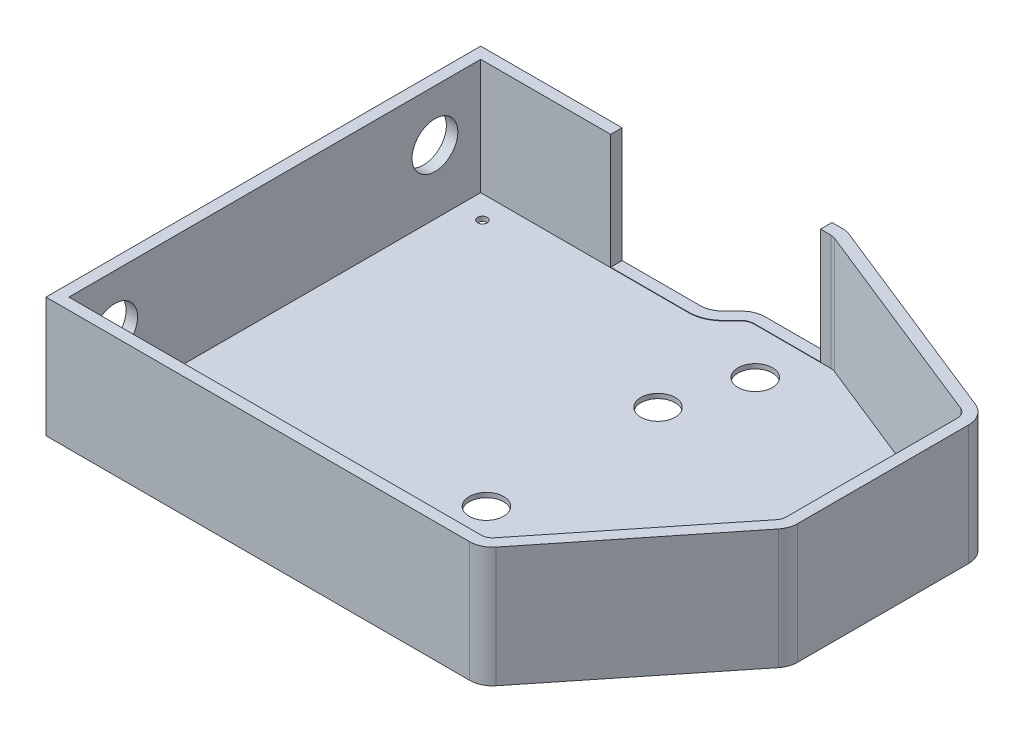
from build123d import *

# Parameters (mm, degrees)
RESSALTO_EXTRUS_O1_DEPTH = 10.5
RESSALTO_EXTRUS_O2_START = -0.405481833
RESSALTO_EXTRUS_O2_DEPTH = 0.405481833
ESBO_O6_R                = 1.5
ESBO_O6_R_2              = 0.439880444
ESBO_O6_R_3              = 0.420000653
CORTE_EXTRUS_O1_DEPTH    = 10
ESBO_O7_R                = 2
CORTE_EXTRUS_O2_DEPTH    = 10
ESBO_O8_W                = 16.345048289
ESBO_O8_H                = 10.10072272
CORTE_EXTRUS_O3_DEPTH    = 6


with BuildPart() as part:
    # Esboço1 → Ressalto-extrusão1 (new body)
    with BuildSketch(Plane.XZ.offset(-2000)):
        with BuildLine():
            Line((26.191736717, -104.725419486), (63.230487022, -104.725419486))
            ThreePointArc((63.230487022, -104.725419486), (64.096864483, -104.922813013), (64.79222464, -105.476029391))
            Line((64.79222464, -105.476029391), (75.753474335, -119.17759151))
            ThreePointArc((75.753474335, -119.17759151), (76.078993355, -119.764967722), (76.191736717, -120.426981605))
            Line((76.191736717, -120.426981605), (76.191736717, -135.371353563))
            ThreePointArc((76.191736717, -135.371353563), (75.847871178, -136.492611182), (74.934518069, -137.228306945))
            Line((74.934518069, -137.228306945), (56.549353262, -144.582372868))
            ThreePointArc((56.549353262, -144.582372868), (56.184786952, -144.689332259), (55.806571909, -144.725419486))
            Line((55.806571909, -144.725419486), (49.020163841, -144.725419486))
            Line((49.020163841, -144.725419486), (48.505389373, -144.65803617))
            Line((48.505389373, -144.65803617), (48.017411303, -144.455878196))
            Line((48.017411303, -144.455878196), (47.605950279, -144.139633048))
            Line((47.605950279, -144.139633048), (46.777523154, -143.311205924))
            ThreePointArc((46.777523154, -143.311205924), (46.128676457, -142.877660421), (45.363309592, -142.725419486))
            Line((45.363309592, -142.725419486), (26.191736717, -142.725419486))
            Line((26.191736717, -142.725419486), (26.191736717, -104.725419486))
        make_face()
        with BuildLine():
            Line((48.266993092, -143.386462299), (47.484629935, -142.604099142))
            ThreePointArc((47.484629935, -142.604099142), (46.511359889, -141.953780888), (45.363309592, -141.725419486))
            Line((45.363309592, -141.725419486), (27.191736717, -141.725419486))
            Line((27.191736717, -141.725419486), (27.191736717, -105.725419486))
            Line((27.191736717, -105.725419486), (63.230487022, -105.725419486))
            ThreePointArc((63.230487022, -105.725419486), (63.663675752, -105.82411625), (64.011355831, -106.100724438))
            Line((64.011355831, -106.100724438), (74.972605526, -119.802286557))
            ThreePointArc((74.972605526, -119.802286557), (75.135365036, -120.095974663), (75.191736717, -120.426981605))
            Line((75.191736717, -120.426981605), (75.191736717, -135.371353563))
            ThreePointArc((75.191736717, -135.371353563), (75.019803947, -135.931982372), (74.563127393, -136.299830254))
            Line((74.563127393, -136.299830254), (56.177962586, -143.653896177))
            ThreePointArc((56.177962586, -143.653896177), (55.995679431, -143.707375873), (55.806571909, -143.725419486))
            Line((55.806571909, -143.725419486), (49.085335215, -143.725419486))
            Line((49.085335215, -143.725419486), (48.766120713, -143.683634718))
            Line((48.766120713, -143.683634718), (48.522121146, -143.582551368))
            Line((48.522121146, -143.582551368), (48.266993092, -143.386462299))
        make_face(mode=Mode.SUBTRACT)
    extrude(amount=RESSALTO_EXTRUS_O1_DEPTH)

    # Esboço5 → Ressalto-extrusão2 (add)
    with BuildSketch(Plane.XZ.offset(-1989.5).offset(RESSALTO_EXTRUS_O2_START)):
        with BuildLine():
            Line((27.191736717, -105.725419486), (63.230487022, -105.725419486))
            ThreePointArc((63.230487022, -105.725419486), (63.663675752, -105.82411625), (64.011355831, -106.100724438))
            Line((64.011355831, -106.100724438), (74.972605526, -119.802286557))
            ThreePointArc((74.972605526, -119.802286557), (75.135365036, -120.095974663), (75.191736717, -120.426981605))
            Line((75.191736717, -120.426981605), (75.191736717, -135.371353563))
            ThreePointArc((75.191736717, -135.371353563), (75.019803947, -135.931982372), (74.563127393, -136.299830254))
            Line((74.563127393, -136.299830254), (56.177962586, -143.653896177))
            ThreePointArc((56.177962586, -143.653896177), (55.995679431, -143.707375873), (55.806571909, -143.725419486))
            Line((55.806571909, -143.725419486), (49.085335215, -143.725419486))
            ThreePointArc((49.085335215, -143.725419486), (48.642453796, -143.637327588), (48.266993092, -143.386462299))
            Line((48.266993092, -143.386462299), (47.484629935, -142.604099142))
            ThreePointArc((47.484629935, -142.604099142), (46.511359889, -141.953780888), (45.363309592, -141.725419486))
            Line((45.363309592, -141.725419486), (27.191736717, -141.725419486))
            Line((27.191736717, -141.725419486), (27.191736717, -105.725419486))
        make_face()
    extrude(amount=RESSALTO_EXTRUS_O2_DEPTH)

    # Esboço6 → Corte-extrusão1 (cut)
    with BuildSketch(Plane.XZ.offset(-1989.5)):
        with Locations(Location((51.191736717, -118.225419486, 0), (0, 0, 270))):
            Circle(ESBO_O6_R)
        with Locations(Location((51.191736717, -133.225419486, 0), (0, 0, 270))):
            Circle(ESBO_O6_R)
        with Locations(Location((72.191736717, -130.725419486, 0), (0, 0, 270))):
            Circle(ESBO_O6_R)
        with Locations(Location((53.191736717, -139.725419486, 0), (0, 0, 270))):
            Circle(ESBO_O6_R)
        with Locations(Location((28.899554792, -108.599940214, 0), (0, 0, 270))):
            Circle(ESBO_O6_R_2)
        with Locations(Location((29.339435236, -139.725419486, 0), (0, 0, 270))):
            Circle(ESBO_O6_R_3)
    extrude(amount=-CORTE_EXTRUS_O1_DEPTH, mode=Mode.SUBTRACT)

    # Esboço7 → Corte-extrusão2 (cut)
    with BuildSketch(Plane.ZY.offset(-26.191736717)):
        with Locations(Location((-137.725419486, 1995.5, 0), (0, 0, 270))):
            Circle(ESBO_O7_R)
        with Locations(Location((-109.725419486, 1995.5, 0), (0, 0, 270))):
            Circle(ESBO_O7_R)
    extrude(amount=-CORTE_EXTRUS_O2_DEPTH, mode=Mode.SUBTRACT)

    # Esboço8 → Corte-extrusão3 (cut)
    with BuildSketch(Plane(origin=(0, 0, -144.725419486), x_dir=(-1, 0, 0), z_dir=(0, 0, -1))):
        with Locations((-46.726167809, 1994.995129696)):
            Rectangle(ESBO_O8_W, ESBO_O8_H)
    extrude(amount=-CORTE_EXTRUS_O3_DEPTH, mode=Mode.SUBTRACT)


solid = part.part
